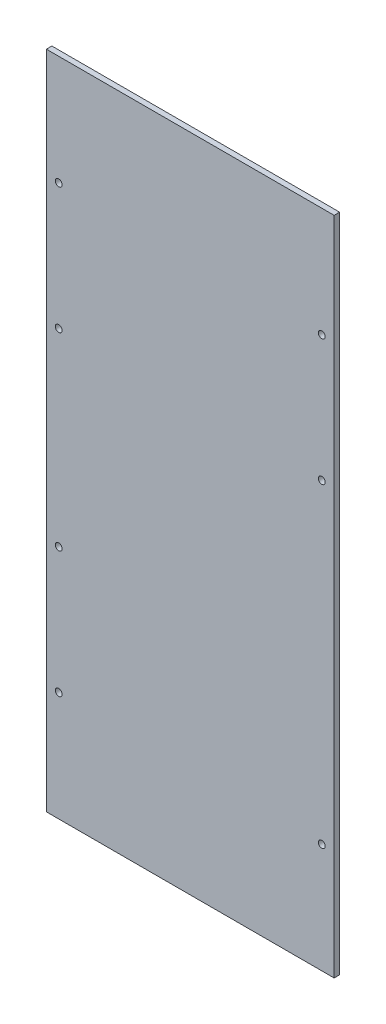
from build123d import *

# Parameters (mm, degrees)
CROQUIS1_W              = 210
CROQUIS1_H              = 482
CROQUIS1_R              = 2.5
SALIENTE_EXTRUIR1_DEPTH = 4


with BuildPart() as part:
    # Croquis1 → Saliente-Extruir1 (new body)
    with BuildSketch(Plane.XY):
        with Locations((14.498385096, 944.628389678)):
            Rectangle(CROQUIS1_W, CROQUIS1_H)
        with Locations((110.498385096, 1105.638389678)):
            Circle(CROQUIS1_R, mode=Mode.SUBTRACT)
        with Locations((-81.501614904, 1105.638389678)):
            Circle(CROQUIS1_R, mode=Mode.SUBTRACT)
        with Locations((-81.501614904, 1013.638389678)):
            Circle(CROQUIS1_R, mode=Mode.SUBTRACT)
        with Locations((110.498385096, 1013.638389678)):
            Circle(CROQUIS1_R, mode=Mode.SUBTRACT)
        with Locations((-81.501614904, 875.618389678)):
            Circle(CROQUIS1_R, mode=Mode.SUBTRACT)
        with Locations((110.498385096, 783.618389678)):
            Circle(CROQUIS1_R, mode=Mode.SUBTRACT)
        with Locations((-81.501614904, 783.618389678)):
            Circle(CROQUIS1_R, mode=Mode.SUBTRACT)
    extrude(amount=SALIENTE_EXTRUIR1_DEPTH)


solid = part.part
